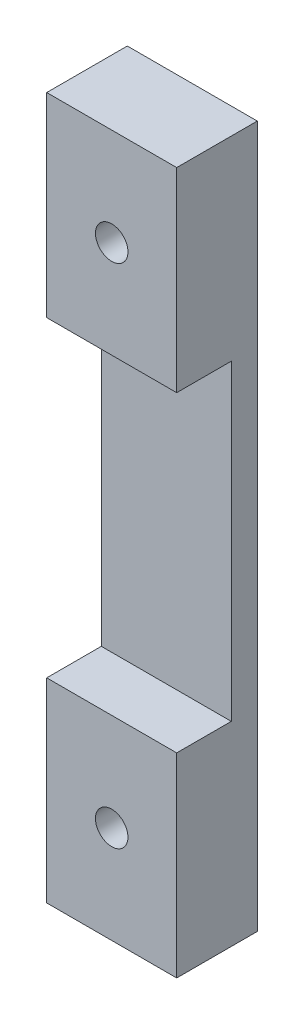
from build123d import *

# Parameters (mm, degrees)
SKETCH_1_W          = 10
SKETCH_1_H          = 54
EXTRUDE_1_DEPTH     = 2
SKETCH_2_W          = 10
SKETCH_2_H          = 15
EXTRUDE_2_DEPTH     = 4.2
SKETCH_3_R          = 1.25
CUT_EXTRUDE_1_DEPTH = 83.01490969


with BuildPart() as part:
    # 草圖1 → 填料-伸長1 (new body)
    with BuildSketch(Plane.XY):
        with Locations((-56.635565313, 26.75)):
            Rectangle(SKETCH_1_W, SKETCH_1_H)
    extrude(amount=EXTRUDE_1_DEPTH)

    # 草圖2 → 填料-伸長2 (add)
    with BuildSketch(Plane.XY.offset(2)):
        with Locations((-56.635565313, 7.25)):
            Rectangle(SKETCH_2_W, SKETCH_2_H)
        with Locations((-56.635565313, 46.25)):
            Rectangle(SKETCH_2_W, SKETCH_2_H)
    extrude(amount=EXTRUDE_2_DEPTH)

    # 草圖3 → 除料-伸長1 (cut, through all)
    with BuildSketch(Plane.XY.offset(6.2)):
        with Locations((-56.635565313, 7.25)):
            Circle(SKETCH_3_R)
        with Locations((-56.635565313, 46.25)):
            Circle(SKETCH_3_R)
    extrude(amount=-CUT_EXTRUDE_1_DEPTH, mode=Mode.SUBTRACT)


solid = part.part
